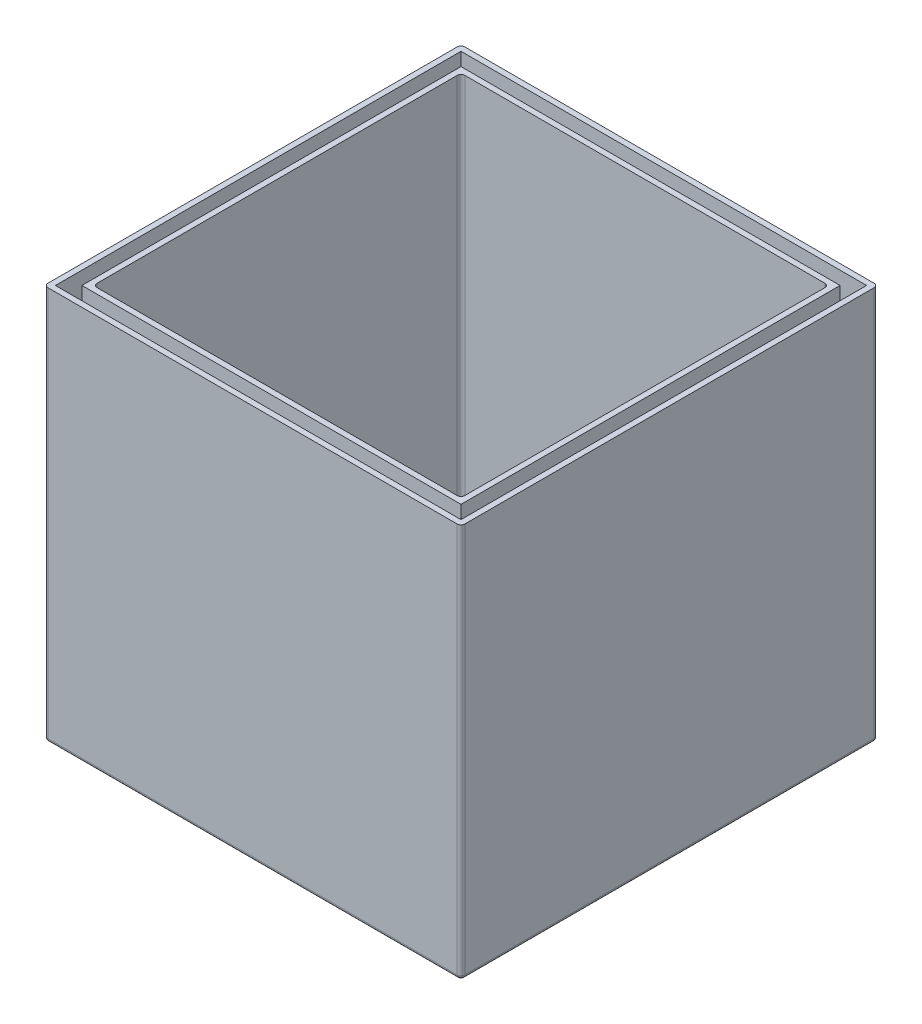
from build123d import *

# Parameters (mm, degrees)
SKETCH1_W             = 200
SKETCH1_H             = 200
SKETCH1_W_2           = 194
SKETCH1_H_2           = 194
BOSS_EXTRUDE1_DEPTH   = 205
SKETCH1_W_3           = 220
SKETCH1_H_3           = 220
SKETCH1_W_4           = 214
SKETCH1_H_4           = 214
BOSS_EXTRUDE1_2_DEPTH = 205
SKETCH3_W             = 220
SKETCH3_H             = 220
BOSS_EXTRUDE3_DEPTH   = 3
FILLET1_R             = 2


with BuildPart() as part:
    # Sketch1 → Boss-Extrude1 (new body)
    with BuildSketch(Plane(origin=(0, 0, 0), x_dir=(1, 0, 0), z_dir=(0, 1, 0))):
        Rectangle(SKETCH1_W, SKETCH1_H)
        Rectangle(SKETCH1_W_2, SKETCH1_H_2, mode=Mode.SUBTRACT)
    extrude(amount=BOSS_EXTRUDE1_DEPTH)



with BuildPart() as body_2:
    # Sketch1 → Boss-Extrude1 2 (new body)
    with BuildSketch(Plane(origin=(0, 0, 0), x_dir=(1, 0, 0), z_dir=(0, 1, 0))):
        Rectangle(SKETCH1_W_3, SKETCH1_H_3)
        Rectangle(SKETCH1_W_4, SKETCH1_H_4, mode=Mode.SUBTRACT)
    extrude(amount=BOSS_EXTRUDE1_2_DEPTH)


with BuildPart() as part_1:
    add(part.part)

    add(body_2.part)  # Boss-Extrude3 merges body 2
    # Sketch3 → Boss-Extrude3 (add)
    with BuildSketch(Plane.XZ):
        Rectangle(SKETCH3_W, SKETCH3_H)
    extrude(amount=BOSS_EXTRUDE3_DEPTH)

    # Fillet1
    fillet1_edges = [part_1.edges().sort_by_distance(p)[0] for p in [
        (-97, 0, 0),
        (0, 0, 97),
        (97, 0, 0),
        (0, 0, -97),
        (-97, 102.5, -97),
        (-97, 102.5, 97),
        (97, 102.5, 97),
        (97, 102.5, -97),
        (110, 101, -110),
        (110, 101, 110),
        (-110, 101, 110),
        (-110, 101, -110),
        (110, -3, 0),
        (0, -3, 110),
        (-110, -3, 0),
        (0, -3, -110),
    ]]
    fillet(fillet1_edges, radius=FILLET1_R)


solid = part_1.part
